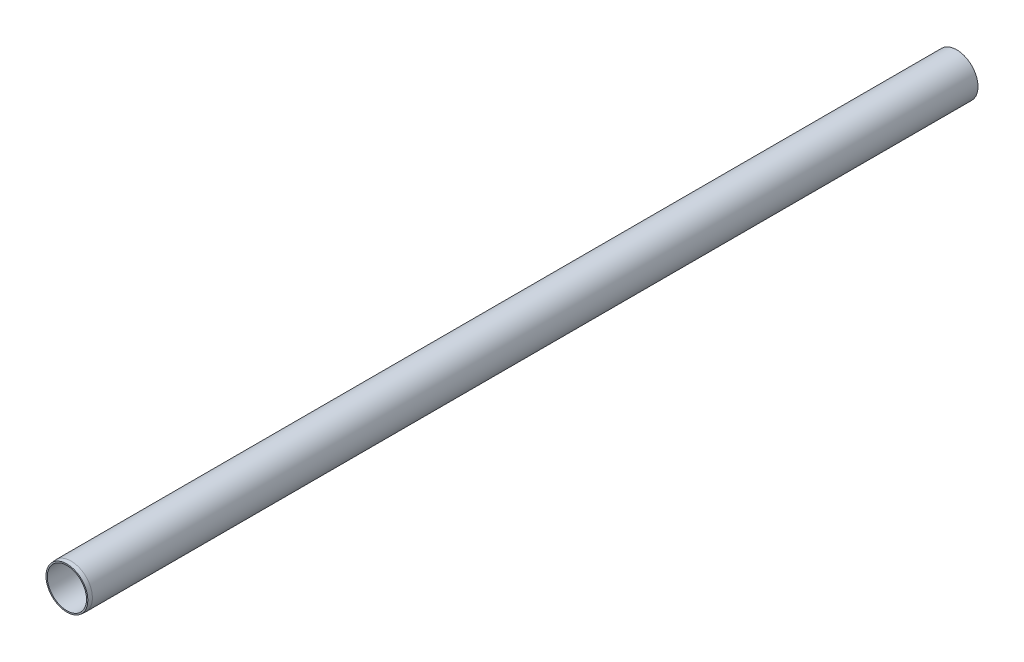
from build123d import *

# Parameters (mm, degrees)
SKETCH1_R           = 20.6756
SKETCH1_R_2         = 19.05
BOSS_EXTRUDE1_DEPTH = 863.6
CHAMFER1_SIZE       = 0.3556
CHAMFER1_SIZE2      = 4.064526599


with BuildPart() as part:
    # Sketch1 → Boss-Extrude1 (new body)
    with BuildSketch(Plane.XY):
        Circle(SKETCH1_R)
        Circle(SKETCH1_R_2, mode=Mode.SUBTRACT)
    extrude(amount=BOSS_EXTRUDE1_DEPTH)

    # Chamfer1
    chamfer1_edges = [part.edges().sort_by_distance(p)[0] for p in [
        (-20.6756, 0, 863.6),
    ]]
    chamfer1_side = [part.faces().sort_by_distance(p)[0] for p in [
        (-20.090805721, 0, 863.6),
    ]]
    chamfer(chamfer1_edges, length=CHAMFER1_SIZE, length2=CHAMFER1_SIZE2, reference=chamfer1_side[0])


solid = part.part
